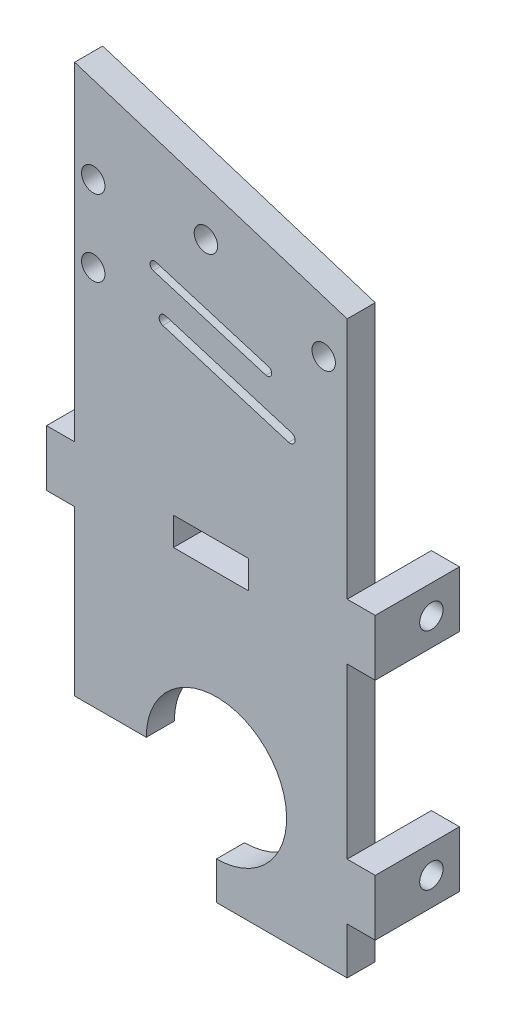
from build123d import *

# Parameters (mm, degrees)
SKETCH1_W                 = 29.13
SKETCH1_H                 = 2
BOSS_EXTRUDE1_DEPTH       = 45.22
SKETCH15_W                = 3.835
SKETCH15_H                = 2
BOSS_EXTRUDE7_DEPTH       = 25.02
CUT_EXTRUDE5_DEPTH        = 4
SKETCH19_W                = 2
SKETCH19_H                = 6
BOSS_EXTRUDE9_DEPTH       = 3
SKETCH20_W                = 3
SKETCH20_H                = 6
BOSS_EXTRUDE10_DEPTH      = 6
SKETCH21_R                = 1.25
CUT_EXTRUDE6_DEPTH        = 6
CUT_EXTRUDE10_DEPTH       = 4
SKETCH27_R                = 1.25
CUT_EXTRUDE13_DEPTH       = 5
CUT_EXTRUDE16_DEPTH       = 4.86
CUT_EXTRUDE17_DEPTH       = 4
CUT_EXTRUDE20_DEPTH       = 15
SKETCH28_R                = 1.25
CUT_EXTRUDE23_DEPTH       = 5
SKETCH32_R                = 1.25
CUT_EXTRUDE25_DEPTH       = 5
SKETCH38_W                = 2
SKETCH38_H                = 6
BOSS_EXTRUDE11_DEPTH      = 3
SKETCH39_W                = 3
SKETCH39_H                = 6
BOSS_EXTRUDE12_DEPTH      = 6
SKETCH40_R                = 1.250000005
CUT_EXTRUDE26_DEPTH       = 6
SKETCH51_W                = 2
SKETCH51_H                = 6
BOSS_EXTRUDE15_DEPTH      = 3
SKETCH52_W                = 3
SKETCH52_H                = 6
BOSS_EXTRUDE16_DEPTH      = 6
SKETCH53_R                = 1.249999995
CUT_EXTRUDE28_DEPTH       = 6
BOSS_EXTRUDE17_DEPTH      = 1
BOSS_EXTRUDE17_DEPTH_BACK = 2
CUT_EXTRUDE29_DEPTH       = 1
CUT_EXTRUDE29_DEPTH_BACK  = 2
SKETCH54_3_R              = 7.5
BOSS_EXTRUDE18_DEPTH      = 1
BOSS_EXTRUDE18_DEPTH_BACK = 2
SKETCH55_R                = 1.25
CUT_EXTRUDE30_DEPTH       = 10


with BuildPart() as part:
    # Sketch1 → Boss-Extrude1 (new body)
    with BuildSketch(Plane(origin=(0, 0, 0), x_dir=(1, 0, 0), z_dir=(0, 1, 0))):
        with Locations((-35.580481579, -22.688974349)):
            Rectangle(SKETCH1_W, SKETCH1_H)
    extrude(amount=BOSS_EXTRUDE1_DEPTH)

    # Sketch15 → Boss-Extrude7 (add)
    with BuildSketch(Plane.XZ):
        with Locations((-22.932981579, 22.688974349)):
            Rectangle(SKETCH15_W, SKETCH15_H)
    extrude(amount=BOSS_EXTRUDE7_DEPTH)

    # Sketch16 → Cut-Extrude5 (cut)
    with BuildSketch(Plane.XY.offset(23.688974349)):
        Polygon((-24.850481579, 0), (-21.015481579, -25.02), (-24.850481579, -25.02), align=None)
    extrude(amount=-CUT_EXTRUDE5_DEPTH, mode=Mode.SUBTRACT)

    # Sketch19 → Boss-Extrude9 (add)
    with BuildSketch(Plane(origin=(-21.015481579, 0, 0), x_dir=(0, 0, -1), z_dir=(1, 0, 0))):
        with Locations((-22.688974349, -17.02)):
            Rectangle(SKETCH19_W, SKETCH19_H)
    extrude(amount=BOSS_EXTRUDE9_DEPTH)

    # Sketch20 → Boss-Extrude10 (add)
    with BuildSketch(Plane(origin=(0, 0, 21.688974349), x_dir=(-1, 0, 0), z_dir=(0, 0, -1))):
        with Locations((19.515481579, -17.02)):
            Rectangle(SKETCH20_W, SKETCH20_H)
    extrude(amount=BOSS_EXTRUDE10_DEPTH)

    # Sketch21 → Cut-Extrude6 (cut)
    with BuildSketch(Plane(origin=(-18.015481579, 0, 0), x_dir=(0, 0, -1), z_dir=(1, 0, 0))):
        with Locations((-18.688974344, -17.012020694)):
            Circle(SKETCH21_R)
    extrude(amount=-CUT_EXTRUDE6_DEPTH, mode=Mode.SUBTRACT)

    # Sketch24 → Cut-Extrude10 (cut)
    with BuildSketch(Plane.XY.offset(23.688974349)):
        Polygon((-21.015481579, 45.22), (-21.015481579, 37.57), (-50.145481579, 45.22), align=None)
    extrude(amount=-CUT_EXTRUDE10_DEPTH, mode=Mode.SUBTRACT)

    # Sketch27 → Cut-Extrude13 (cut)
    with BuildSketch(Plane.XY.offset(23.688974349)):
        with Locations((-48.155481578, 35.325814088)):
            Circle(SKETCH27_R)
        with Locations((-48.155481579, 27.181192798)):
            Circle(SKETCH27_R)
    extrude(amount=-CUT_EXTRUDE13_DEPTH, mode=Mode.SUBTRACT)

    # Sketch35 → Cut-Extrude16 (cut)
    with BuildSketch(Plane.XY.offset(23.688974349)):
        Polygon((-21.015481579, 35.99), (-21.015481579, 37.57), (-50.145481579, 45.22), align=None)
    extrude(amount=-CUT_EXTRUDE16_DEPTH, mode=Mode.SUBTRACT)

    # Sketch36 → Cut-Extrude17 (cut)
    with BuildSketch(Plane.XY.offset(23.688974349)):
        Polygon((-50.145481579, 45.22), (-50.145481579, 45.18), (-21.015481579, 35.99), align=None)
    extrude(amount=-CUT_EXTRUDE17_DEPTH, mode=Mode.SUBTRACT)


with BuildPart() as body_2:
    # Mirror1: mirrored copy
    add(part.part.mirror(Plane(origin=(0, 0, 15.688974349), x_dir=(1, 0, 0), z_dir=(0, 0, -1))))

    # Sketch37 → Cut-Extrude20 (cut)
    with BuildSketch(Plane(origin=(0, 0, 7.688974349), x_dir=(-1, 0, 0), z_dir=(0, 0, -1))):
        with BuildLine():
            Line((29.422391304, 27.369440111), (41.452993211, 31.026802565))
            ThreePointArc((41.452993211, 31.026802565), (42.065476612, 30.699897808), (41.738571855, 30.087414406))
            Line((41.738571855, 30.087414406), (29.707969948, 26.430051952))
            ThreePointArc((29.707969948, 26.430051952), (29.095486546, 26.75695671), (29.422391304, 27.369440111))
        make_face()
        with BuildLine():
            Line((26.963881394, 22.478846245), (40.405895564, 26.565285004))
            ThreePointArc((40.405895564, 26.565285004), (41.083801623, 26.203461785), (40.721978404, 25.525555725))
            Line((40.721978404, 25.525555725), (27.279964235, 21.439116966))
            ThreePointArc((27.279964235, 21.439116966), (26.602058175, 21.800940185), (26.963881394, 22.478846245))
        make_face()
    extrude(amount=-CUT_EXTRUDE20_DEPTH, mode=Mode.SUBTRACT)


with BuildPart() as body_2_2:
    # Mirror2: mirrored copy
    add(body_2.part.mirror(Plane.XY.offset(15.688974349)))

    # Sketch28 → Cut-Extrude23 (cut)
    with BuildSketch(Plane.XY.offset(23.688974349)):
        with Locations((-23.525481579, 31.253503442)):
            Circle(SKETCH28_R)
    extrude(amount=-CUT_EXTRUDE23_DEPTH, mode=Mode.SUBTRACT)

    # Sketch32 → Cut-Extrude25 (cut)
    with BuildSketch(Plane.XY.offset(23.688974349)):
        with Locations((-36.114456583, 35.789812976)):
            Circle(SKETCH32_R)
    extrude(amount=-CUT_EXTRUDE25_DEPTH, mode=Mode.SUBTRACT)

    # Sketch38 → Boss-Extrude11 (add)
    with BuildSketch(Plane.ZY.offset(50.145481579)):
        with Locations((22.688974349, 7.042669101)):
            Rectangle(SKETCH38_W, SKETCH38_H)
    extrude(amount=BOSS_EXTRUDE11_DEPTH)

    # Sketch39 → Boss-Extrude12 (add)
    with BuildSketch(Plane(origin=(0, 0, 21.688974349), x_dir=(-1, 0, 0), z_dir=(0, 0, -1))):
        with Locations((51.645481579, 7.042669101)):
            Rectangle(SKETCH39_W, SKETCH39_H)
    extrude(amount=BOSS_EXTRUDE12_DEPTH)

    # Sketch40 → Cut-Extrude26 (cut)
    with BuildSketch(Plane.ZY.offset(53.145481579)):
        with Locations((18.688974344, 6.98)):
            Circle(SKETCH40_R)
    extrude(amount=-CUT_EXTRUDE26_DEPTH, mode=Mode.SUBTRACT)

    # Sketch51 → Boss-Extrude15 (add)
    with BuildSketch(Plane(origin=(-21.015481579, 0, 0), x_dir=(0, 0, -1), z_dir=(1, 0, 0))):
        with Locations((-22.688974349, 7.042669101)):
            Rectangle(SKETCH51_W, SKETCH51_H)
    extrude(amount=BOSS_EXTRUDE15_DEPTH)

    # Sketch52 → Boss-Extrude16 (add)
    with BuildSketch(Plane(origin=(0, 0, 21.688974349), x_dir=(-1, 0, 0), z_dir=(0, 0, -1))):
        with Locations((19.515481579, 7.042669101)):
            Rectangle(SKETCH52_W, SKETCH52_H)
    extrude(amount=BOSS_EXTRUDE16_DEPTH)

    # Sketch53 → Cut-Extrude28 (cut)
    with BuildSketch(Plane(origin=(-18.015481579, 0, 0), x_dir=(0, 0, -1), z_dir=(1, 0, 0))):
        with Locations(Location((-18.688974344, 6.98, 0), (0, 0, 180))):
            Circle(SKETCH53_R)
    extrude(amount=-CUT_EXTRUDE28_DEPTH, mode=Mode.SUBTRACT)

    # Sketch54 → Boss-Extrude17 (add, two sides: drawn at the far end of the back side and taken through both)
    with BuildSketch(Plane.XY.offset(23.688974349).offset(-BOSS_EXTRUDE17_DEPTH_BACK)):
        Polygon((-50.145481579, 0), (-50.145481579, -13.48149478), (-34.98674486, -13.48149478), (-34.98674486, -25.02), (-21.015481579, -25.02), (-24.850481579, 0), align=None)
    extrude(amount=BOSS_EXTRUDE17_DEPTH + BOSS_EXTRUDE17_DEPTH_BACK)

    # Sketch54<3> → Cut-Extrude29 (cut, two sides: drawn at the far end of the back side and taken through both)
    with BuildSketch(Plane.XY.offset(23.688974349).offset(-CUT_EXTRUDE29_DEPTH_BACK)):
        with Locations((-34.98674486, -13.48149478)):
            Circle(SKETCH54_3_R)
    extrude(amount=CUT_EXTRUDE29_DEPTH + CUT_EXTRUDE29_DEPTH_BACK, mode=Mode.SUBTRACT)

    # Sketch55 → Boss-Extrude18 (add, two sides: drawn at the far end of the back side and taken through both)
    with BuildSketch(Plane.XY.offset(23.688974349).offset(-BOSS_EXTRUDE18_DEPTH_BACK)):
        Polygon((-50.145481579, 45.18), (-50.145481579, 10.042669101), (-53.145481579, 10.042669101), (-53.145481579, 4.042669101), (-50.145481579, 4.042669101), (-50.145481579, 0), (-24.850481579, 0), (-21.015481579, -25.02), (-21.015481579, -20.02), (-18.015481579, -20.02), (-18.015481579, -14.02), (-21.015481579, -14.02), (-21.015481579, 4.042669101), (-18.015481579, 4.042669101), (-18.015481579, 10.042669101), (-21.015481579, 10.042669101), (-21.015481579, 35.99), align=None)
        with Locations((-23.525481579, 31.253503442)):
            Circle(SKETCH55_R, mode=Mode.SUBTRACT)
        with Locations((-36.114456583, 35.789812976)):
            Circle(SKETCH55_R, mode=Mode.SUBTRACT)
        with Locations((-48.155481578, 35.325814088)):
            Circle(SKETCH55_R, mode=Mode.SUBTRACT)
        with Locations((-48.155481579, 27.181192798)):
            Circle(SKETCH55_R, mode=Mode.SUBTRACT)
        with BuildLine():
            Line((-41.453555794, 31.024951992), (-29.422953887, 27.367589538))
            ThreePointArc((-29.422953887, 27.367589538), (-29.097337119, 26.757519293), (-29.707407364, 26.431902525))
            Line((-29.707407364, 26.431902525), (-41.738009272, 30.089264979))
            ThreePointArc((-41.738009272, 30.089264979), (-42.063626039, 30.699335224), (-41.453555794, 31.024951992))
        make_face(mode=Mode.SUBTRACT)
        with BuildLine():
            Line((-27.280327459, 21.437922169), (-40.722341628, 25.524360928))
            ThreePointArc((-40.722341628, 25.524360928), (-41.08499642, 26.203825009), (-40.405532339, 26.566479801))
            Line((-40.405532339, 26.566479801), (-26.96351817, 22.480041042))
            ThreePointArc((-26.96351817, 22.480041042), (-26.600863378, 21.800576961), (-27.280327459, 21.437922169))
        make_face(mode=Mode.SUBTRACT)
    extrude(amount=BOSS_EXTRUDE18_DEPTH + BOSS_EXTRUDE18_DEPTH_BACK)

    # Sketch56 → Cut-Extrude30 (cut)
    with BuildSketch(Plane.XY.offset(24.688974349)):
        Polygon((-31.58048158, 8.542669101), (-35.580481579, 8.542669101), (-39.58048158, 8.542669101), (-39.58048158, 5.542669101), (-31.58048158, 5.542669101), align=None)
    extrude(amount=-CUT_EXTRUDE30_DEPTH, mode=Mode.SUBTRACT)


solid = body_2_2.part
